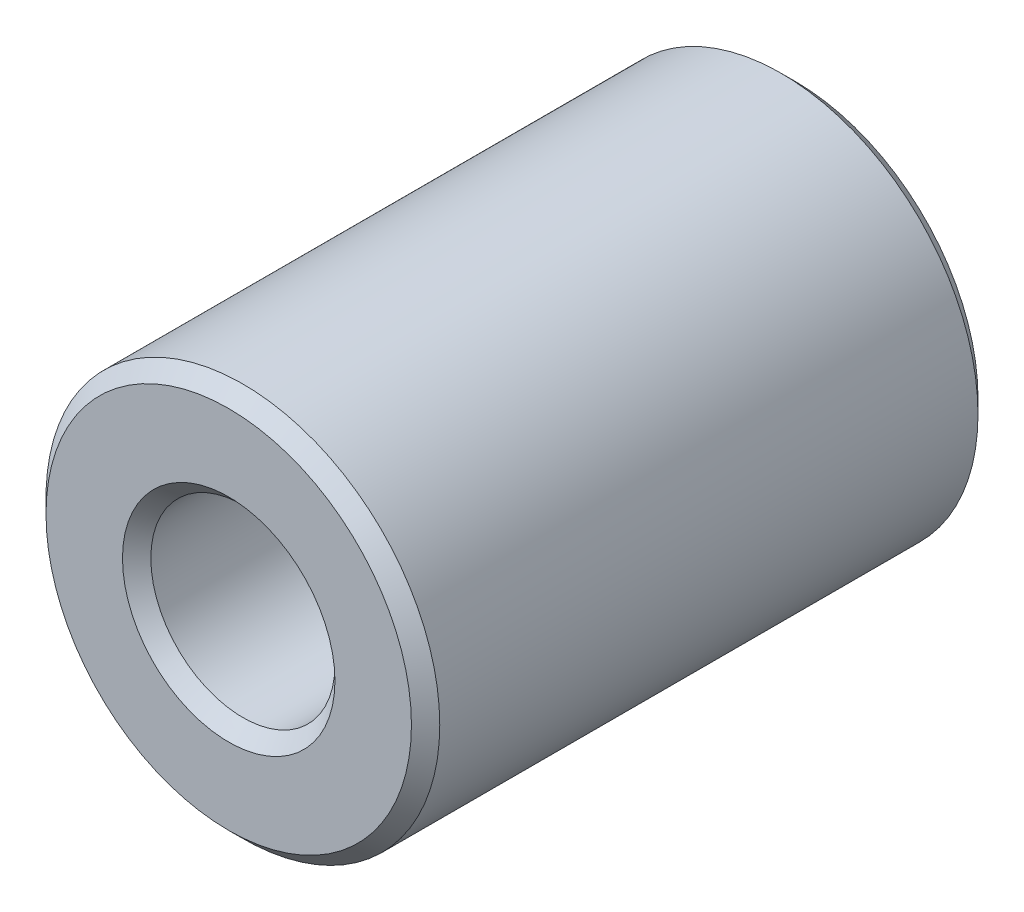
from build123d import *

# Parameters (mm, degrees)
SKETCH_1_R      = 6.95
SKETCH_1_R_2    = 3.25
EXTRUDE_1_DEPTH = 20
CHAMFER_1_SIZE  = 0.5


with BuildPart() as part:
    # 草图1 → 凸台-拉伸1 (new body)
    with BuildSketch(Plane.XY):
        Circle(SKETCH_1_R)
        Circle(SKETCH_1_R_2, mode=Mode.SUBTRACT)
    extrude(amount=EXTRUDE_1_DEPTH)

    # 倒角1
    chamfer_1_edges = [part.edges().sort_by_distance(p)[0] for p in [
        (-6.95, 0, 0),
        (-6.95, 0, 20),
        (-3.25, 0, 0),
        (-3.25, 0, 20),
    ]]
    chamfer(chamfer_1_edges, length=CHAMFER_1_SIZE)


solid = part.part
